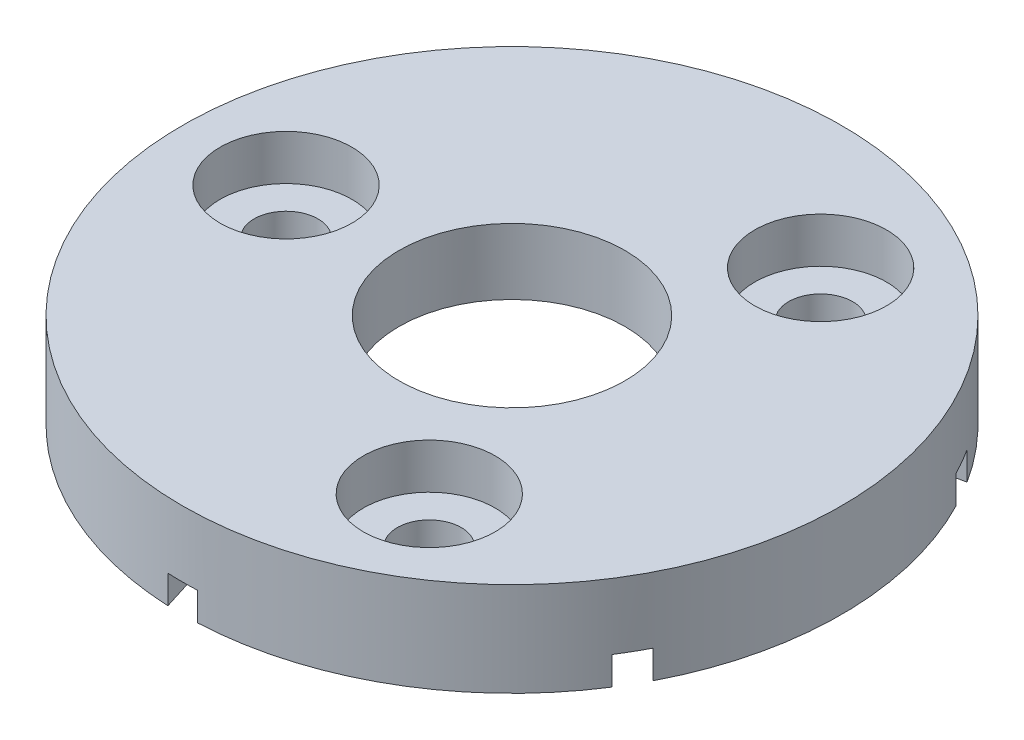
from build123d import *

# Parameters (mm, degrees)
SKETCH1_R                                = 17.5
BOSS_EXTRUDE1_DEPTH                      = 5
CBORE_FOR_M3_PAN_HEAD_SCREW1_D           = 3.4
CBORE_FOR_M3_PAN_HEAD_SCREW1_CBORE_D     = 7
CBORE_FOR_M3_PAN_HEAD_SCREW1_CBORE_DEPTH = 2.4
CIRPATTERN1_COUNT                        = 3
F_12_0_12_DIAMETER_HOLE1_D               = 12
CUT_EXTRUDE1_DEPTH                       = 1.5
CIRPATTERN2_COUNT                        = 6


with BuildPart() as part:
    # Sketch1 → Boss-Extrude1 (new body)
    with BuildSketch(Plane(origin=(0, 0, 0), x_dir=(1, 0, 0), z_dir=(0, 1, 0))):
        with Locations(Location((0, 0, 0), (0, 0, 270))):
            Circle(SKETCH1_R)
    extrude(amount=BOSS_EXTRUDE1_DEPTH)

    # CBORE for M3 Pan Head Screw1 (through all)
    with Locations(Plane(origin=(0, 5, 0), x_dir=(1, 0, 0), z_dir=(0, 1, 0))):
        with Locations((-12, 0)):
            cbore_for_m3_pan_head_screw1 = CounterBoreHole(CBORE_FOR_M3_PAN_HEAD_SCREW1_D / 2, CBORE_FOR_M3_PAN_HEAD_SCREW1_CBORE_D / 2, CBORE_FOR_M3_PAN_HEAD_SCREW1_CBORE_DEPTH)

    # CirPattern1: CBORE for M3 Pan Head Screw1 ×3 about axis
    cirpattern1_axis = Axis((0, 0, 0), (0, 1, 0))
    for i in range(1, CIRPATTERN1_COUNT):
        add(cbore_for_m3_pan_head_screw1.rotate(cirpattern1_axis, i * 360 / CIRPATTERN1_COUNT), mode=Mode.SUBTRACT)

    # Ø12.0 (12) Diameter Hole1 (through all)
    with Locations(Plane(origin=(0, 0, 0), x_dir=(-1, 0, 0), z_dir=(0, -1, 0))):
        with Locations((0, 0)):
            Hole(F_12_0_12_DIAMETER_HOLE1_D / 2)

    # Sketch7 → Cut-Extrude1 (cut)
    with BuildSketch(Plane.XZ):
        Polygon((0, 20), (-5.723634799, 1.800001303), (5.723634799, 1.800001303), align=None)
    cut_extrude1 = extrude(amount=-CUT_EXTRUDE1_DEPTH, mode=Mode.SUBTRACT)

    # CirPattern2: Cut-Extrude1 ×6 about axis
    cirpattern2_axis = Axis((0, 0, 0), (0, 1, 0))
    for i in range(1, CIRPATTERN2_COUNT):
        add(cut_extrude1.rotate(cirpattern2_axis, i * 360 / CIRPATTERN2_COUNT), mode=Mode.SUBTRACT)


solid = part.part
